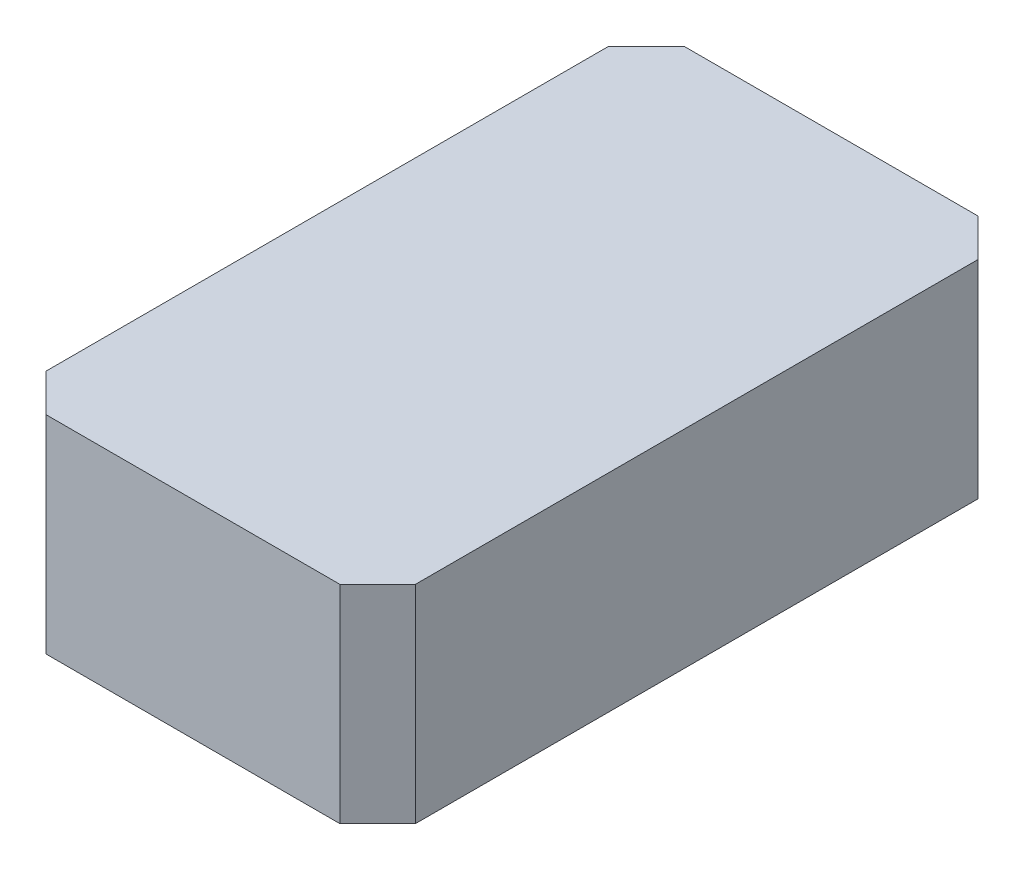
from build123d import *

# Parameters (mm, degrees)
SKETCH1_W           = 7.8
SKETCH1_H           = 1
BOSS_EXTRUDE1_DEPTH = 5
SKETCH2_W           = 7.465
SKETCH2_H           = 0.5
CUT_EXTRUDE1_DEPTH  = 0.5
SKETCH3_W           = 14.93
SKETCH3_H           = 0.5
CUT_EXTRUDE2_DEPTH  = 0.5
BOSS_EXTRUDE2_DEPTH = 0.5
SKETCH5_W           = 1
SKETCH5_H           = 2.195949596
BOSS_EXTRUDE3_DEPTH = 7.5
SKETCH6_W           = 0.2
SKETCH6_H           = 0.5
SKETCH6_W_2         = 0.5
SKETCH6_W_3         = 0.413933432
BOSS_EXTRUDE4_DEPTH = 0.5
SKETCH8_W           = 14.93
SKETCH8_H           = 0.5
CUT_EXTRUDE3_DEPTH  = 0.5
SKETCH9_W           = 14.93
SKETCH9_H           = 0.084331677
CUT_EXTRUDE4_DEPTH  = 0.5
SKETCH12_W          = 14.93
SKETCH12_H          = 1.2
CUT_EXTRUDE5_DEPTH  = 0.5


with BuildPart() as part:
    # Sketch1 → Boss-Extrude1 (new body)
    with BuildSketch(Plane(origin=(0, 0, 0), x_dir=(1, 0, 0), z_dir=(0, 1, 0))):
        with Locations((3.9, 15.43)):
            Rectangle(SKETCH1_W, SKETCH1_H)
        Polygon((7.8, 15.93), (8.8, 14.93), (7.8, 14.93), align=None)
        Polygon((7.8, -1), (7.8, 0), (7.8, 14.93), (8.8, 14.93), (8.8, 0), align=None)
        Polygon((-1, 0), (0, 0), (7.8, 0), (7.8, -1), (0, -1), align=None)
        Polygon((0, 15.93), (0, 14.93), (0, 0), (-1, 0), (-1, 14.93), align=None)
    extrude(amount=BOSS_EXTRUDE1_DEPTH)

    # Sketch2 → Cut-Extrude1 (cut)
    with BuildSketch(Plane(origin=(0, 0, 0), x_dir=(0, 0, -1), z_dir=(1, 0, 0))):
        with Locations((11.1975, 0.75)):
            Rectangle(SKETCH2_W, SKETCH2_H)
        with Locations((3.7325, 0.75)):
            Rectangle(SKETCH2_W, SKETCH2_H)
    extrude(amount=-CUT_EXTRUDE1_DEPTH, mode=Mode.SUBTRACT)

    # Sketch3 → Cut-Extrude2 (cut)
    with BuildSketch(Plane.ZY.offset(-7.8)):
        with Locations((-7.465, 0.75)):
            Rectangle(SKETCH3_W, SKETCH3_H)
    extrude(amount=-CUT_EXTRUDE2_DEPTH, mode=Mode.SUBTRACT)

    # Sketch4 → Boss-Extrude2 (add)
    with BuildSketch(Plane(origin=(0, 5, 0), x_dir=(1, 0, 0), z_dir=(0, 1, 0))):
        Polygon((-1, 0), (0, -1), (7.8, -1), (8.8, 0), (8.8, 14.93), (7.8, 15.93), (0, 15.93), (-1, 14.93), align=None)
    extrude(amount=BOSS_EXTRUDE2_DEPTH)

    # Sketch5 → Boss-Extrude3 (add)
    with BuildSketch(Plane.XZ.offset(-5)):
        with Locations((4.4, -12.832025202)):
            Rectangle(SKETCH5_W, SKETCH5_H)
        with Locations((3.4, -12.832025202)):
            Rectangle(SKETCH5_W, SKETCH5_H)
        with Locations((3.4, -10.636075606)):
            Rectangle(SKETCH5_W, SKETCH5_H)
        with Locations((4.4, -10.636075606)):
            Rectangle(SKETCH5_W, SKETCH5_H)
    extrude(amount=BOSS_EXTRUDE3_DEPTH)

    # Sketch6 → Boss-Extrude4 (add)
    with BuildSketch(Plane.XZ.offset(2.5)):
        with Locations((4, -10.984050404)):
            Rectangle(SKETCH6_W, SKETCH6_H)
        with Locations((3.8, -10.984050404)):
            Rectangle(SKETCH6_W, SKETCH6_H)
        with Locations((3.8, -11.484050404)):
            Rectangle(SKETCH6_W, SKETCH6_H)
        with Locations((4, -11.484050404)):
            Rectangle(SKETCH6_W, SKETCH6_H)
        with Locations((4.35, -11.484050404)):
            Rectangle(SKETCH6_W_2, SKETCH6_H)
        with Locations((4.35, -11.984050404)):
            Rectangle(SKETCH6_W_2, SKETCH6_H)
        Polygon((3.9, -11.734050404), (3.7, -11.734050404), (3.7, -12.234050404), (3.986066568, -12.234050404), (4.1, -12.234050404), (4.1, -11.734050404), align=None)
        with Locations((3.493033284, -11.484050404)):
            Rectangle(SKETCH6_W_3, SKETCH6_H)
        with Locations((3.493033284, -11.984050404)):
            Rectangle(SKETCH6_W_3, SKETCH6_H)
        Polygon((3.986066568, -12.234050404), (3.7, -12.234050404), (3.7, -12.768693535), (4.1, -12.768693535), (4.1, -12.234050404), align=None)
    extrude(amount=BOSS_EXTRUDE4_DEPTH)

    # Sketch8 → Cut-Extrude3 (cut)
    with BuildSketch(Plane.ZY.offset(-7.8)):
        with Locations((-7.465, 1.334331677)):
            Rectangle(SKETCH8_W, SKETCH8_H)
    extrude(amount=-CUT_EXTRUDE3_DEPTH, mode=Mode.SUBTRACT)

    # Sketch9 → Cut-Extrude4 (cut)
    with BuildSketch(Plane.ZY.offset(-7.8)):
        with Locations((-7.465, 1.042165838)):
            Rectangle(SKETCH9_W, SKETCH9_H)
    extrude(amount=-CUT_EXTRUDE4_DEPTH, mode=Mode.SUBTRACT)

    # Sketch12 → Cut-Extrude5 (cut)
    with BuildSketch(Plane(origin=(0, 0, 0), x_dir=(0, 0, -1), z_dir=(1, 0, 0))):
        with Locations((7.465, 1.6)):
            Rectangle(SKETCH12_W, SKETCH12_H)
    extrude(amount=-CUT_EXTRUDE5_DEPTH, mode=Mode.SUBTRACT)


solid = part.part
